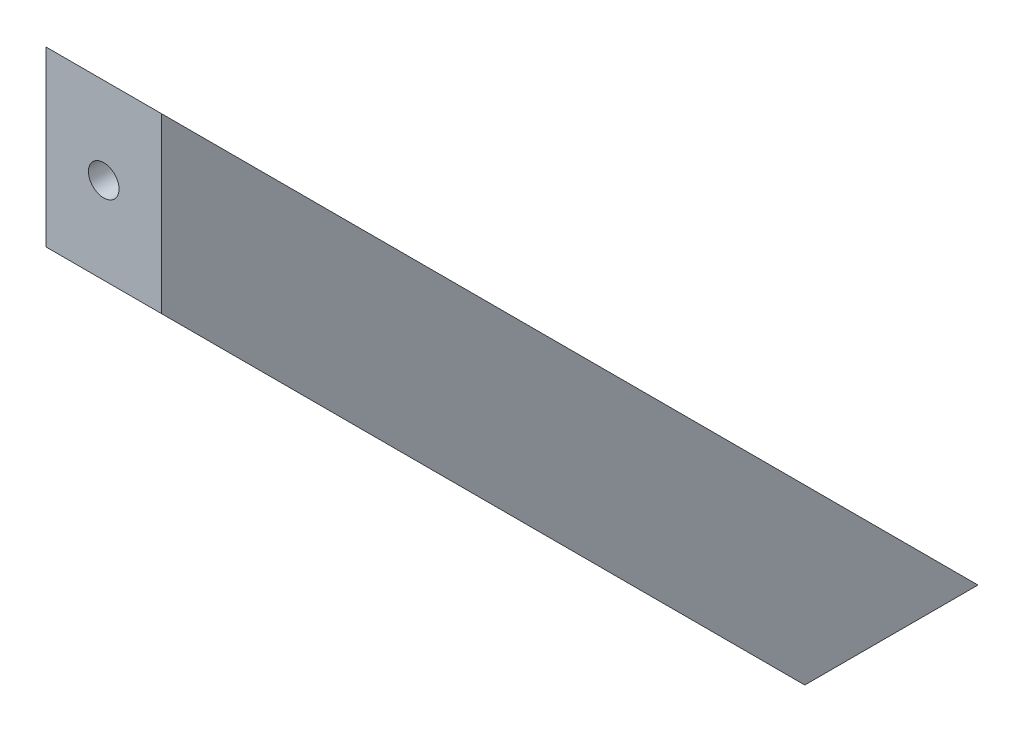
from build123d import *

# Parameters (mm, degrees)
BOSS_EXTRUDE1_DEPTH = 20
SKETCH3_R           = 2.65
CUT_EXTRUDE1_DEPTH  = 182.148333213
SKETCH4_R           = 2.65
CUT_EXTRUDE2_DEPTH  = 201.997512422
SKETCH5_R           = 5.5
CUT_EXTRUDE3_DEPTH  = 198.511484318
SKETCH6_R           = 5.5
CUT_EXTRUDE4_DEPTH  = 178.272403558


with BuildPart() as part:
    # Sketch2 → Boss-Extrude1 (new body)
    with BuildSketch(Plane(origin=(0, 0, 0), x_dir=(0, 0, -1), z_dir=(1, 0, 0))):
        Polygon((0, 0), (-111.421356237, 111.421356237), (-111.421356237, 141.421356237), (30, 0), align=None)
    extrude(amount=BOSS_EXTRUDE1_DEPTH)

    # Sketch3 → Cut-Extrude1 (cut, through all)
    with BuildSketch(Plane.XZ):
        with Locations(Location((10, -15, 0), (0, 0, 270))):
            Circle(SKETCH3_R)
    extrude(amount=-CUT_EXTRUDE1_DEPTH, mode=Mode.SUBTRACT)

    # Sketch4 → Cut-Extrude2 (cut, through all)
    with BuildSketch(Plane.XY.offset(111.421356237)):
        with Locations((10, 126.421356237)):
            Circle(SKETCH4_R)
    extrude(amount=-CUT_EXTRUDE2_DEPTH, mode=Mode.SUBTRACT)

    # Sketch5 → Cut-Extrude3 (cut, through all)
    with BuildSketch(Plane.XY.offset(106.421356237)):
        with Locations((10, 126.421356237)):
            Circle(SKETCH5_R)
    extrude(amount=-CUT_EXTRUDE3_DEPTH, mode=Mode.SUBTRACT)

    # Sketch6 → Cut-Extrude4 (cut, through all)
    with BuildSketch(Plane(origin=(0, 5, 0), x_dir=(-1, 0, 0), z_dir=(0, -1, 0))):
        with Locations(Location((-10, 15, 0), (0, 0, 90))):
            Circle(SKETCH6_R)
    extrude(amount=-CUT_EXTRUDE4_DEPTH, mode=Mode.SUBTRACT)


solid = part.part
